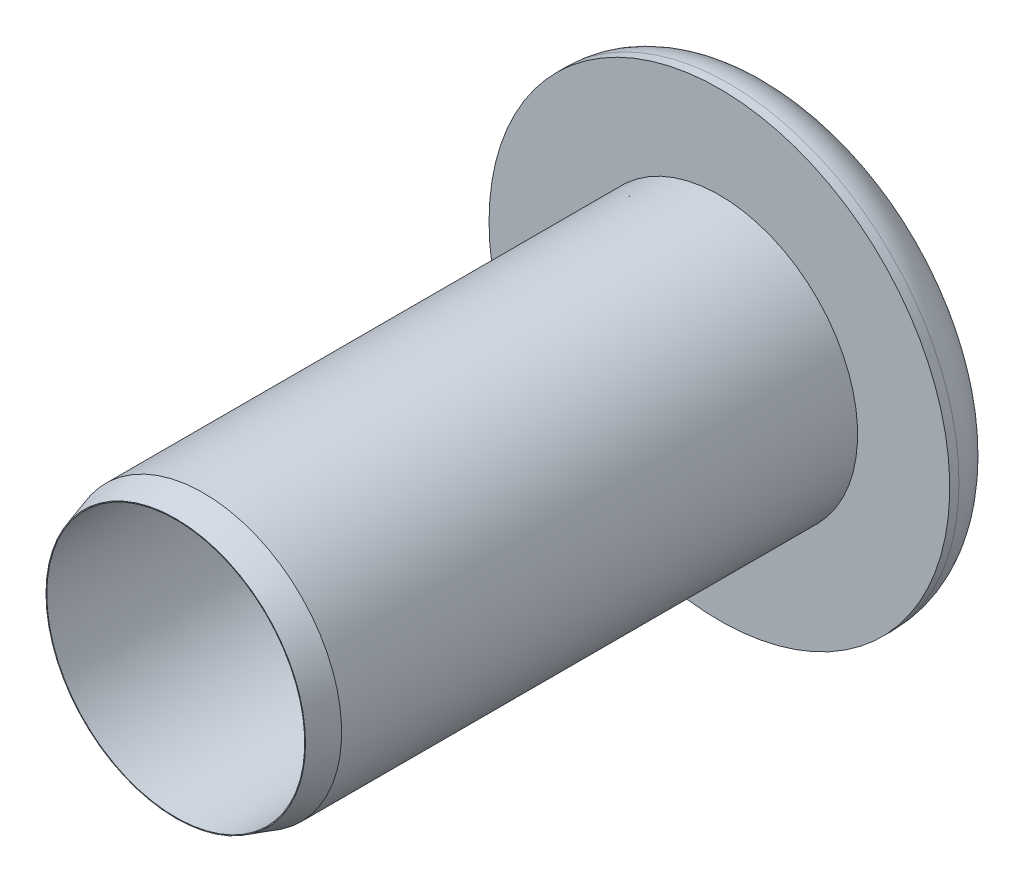
from build123d import *

# Parameters (mm, degrees)
ESBO_O1_R                = 1.5
ESBO_O1_R_2              = 1.4
RESSALTO_EXTRUS_O1_DEPTH = 6.5
ESBO_O2_R                = 2.5
ESBO_O2_R_2              = 1.5
RESSALTO_EXTRUS_O2_DEPTH = 0.6
FILETE1_R                = 0.5
CHANFRO1_SIZE            = 0.3
CHANFRO1_SIZE2           = 0.091719204


with BuildPart() as part:
    # Esboço1 → Ressalto-extrusão1 (new body)
    with BuildSketch(Plane.XY):
        with Locations(Location((0, 0, 0), (0, 0, 180))):
            Circle(ESBO_O1_R)
        with Locations(Location((0, 0, 0), (0, 0, 180))):
            Circle(ESBO_O1_R_2, mode=Mode.SUBTRACT)
    extrude(amount=RESSALTO_EXTRUS_O1_DEPTH)

    # Esboço2 → Ressalto-extrusão2 (add)
    with BuildSketch(Plane(origin=(0, 0, 0), x_dir=(-1, 0, 0), z_dir=(0, 0, -1))):
        Circle(ESBO_O2_R)
        Circle(ESBO_O2_R_2, mode=Mode.SUBTRACT)
    extrude(amount=-RESSALTO_EXTRUS_O2_DEPTH)

    # Filete1
    filete1_edges = [part.edges().sort_by_distance(p)[0] for p in [
        (2.5, 0, 0),
        (1.4, 0, 0),
    ]]
    fillet(filete1_edges, radius=FILETE1_R)

    # Chanfro1
    chanfro1_edges = [part.edges().sort_by_distance(p)[0] for p in [
        (1.5, 0, 6.5),
    ]]
    chanfro1_side = [part.faces().sort_by_distance(p)[0] for p in [
        (1.5, 0, 3.55),
    ]]
    chamfer(chanfro1_edges, length=CHANFRO1_SIZE, length2=CHANFRO1_SIZE2, reference=chanfro1_side[0])


solid = part.part
